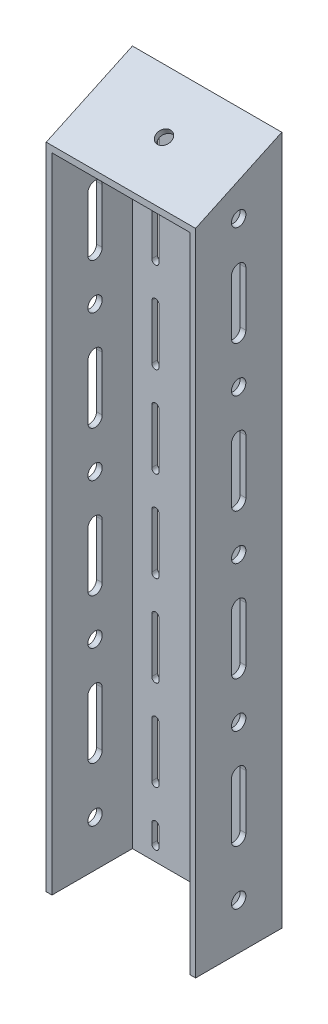
from build123d import *

# Parameters (mm, degrees)
BOSS_EXTRUDE1_DEPTH = 190.5
SKETCH2_R           = 3.96875
CUT_EXTRUDE1_DEPTH  = 190.5
CUT_EXTRUDE2_DEPTH  = 10
CUT_EXTRUDE3_DEPTH  = 100
BOSS_EXTRUDE3_REACH = 198.37
SKETCH7_R           = 3.96875
CUT_EXTRUDE4_DEPTH  = 5


with BuildPart() as part:
    # Sketch1 → Boss-Extrude1 (new, symmetric)
    with BuildSketch(Plane(origin=(0, 0, 0), x_dir=(1, 0, 0), z_dir=(0, 1, 0))):
        Polygon((-38.1, 20.64), (38.1, 20.64), (38.1, -23.815), (41.275, -23.815), (41.275, 23.815), (-41.275, 23.815), (-41.275, -23.815), (-38.1, -23.815), align=None)
    extrude(amount=BOSS_EXTRUDE1_DEPTH, both=True)

    # Sketch2 → Cut-Extrude1 (cut, symmetric)
    with BuildSketch(Plane(origin=(0, 0, 0), x_dir=(0, 0, -1), z_dir=(1, 0, 0))):
        with Locations((0, -165.1)):
            Circle(SKETCH2_R)
        with Locations((0, -79.975)):
            Circle(SKETCH2_R)
        with Locations((0, 0.275)):
            Circle(SKETCH2_R)
        with Locations((0, 80.525)):
            Circle(SKETCH2_R)
        with Locations((0, 161.05)):
            Circle(SKETCH2_R)
        with BuildLine():
            Line((-3.96875, -135.1), (-3.96875, -105.1))
            ThreePointArc((-3.96875, -105.1), (0, -101.13125), (3.96875, -105.1))
            Line((3.96875, -105.1), (3.96875, -135.1))
            ThreePointArc((3.96875, -135.1), (0, -139.06875), (-3.96875, -135.1))
        make_face()
        with BuildLine():
            Line((-3.96875, -54.85), (-3.96875, -24.85))
            ThreePointArc((-3.96875, -24.85), (0, -20.88125), (3.96875, -24.85))
            Line((3.96875, -24.85), (3.96875, -54.85))
            ThreePointArc((3.96875, -54.85), (0, -58.81875), (-3.96875, -54.85))
        make_face()
        with BuildLine():
            Line((-3.96875, 25.4), (-3.96875, 55.4))
            ThreePointArc((-3.96875, 55.4), (0, 59.36875), (3.96875, 55.4))
            Line((3.96875, 55.4), (3.96875, 25.4))
            ThreePointArc((3.96875, 25.4), (0, 21.43125), (-3.96875, 25.4))
        make_face()
        with BuildLine():
            Line((-3.96875, 105.65), (-3.96875, 135.65))
            ThreePointArc((-3.96875, 135.65), (0, 139.61875), (3.96875, 135.65))
            Line((3.96875, 135.65), (3.96875, 105.65))
            ThreePointArc((3.96875, 105.65), (0, 101.68125), (-3.96875, 105.65))
        make_face()
    extrude(amount=CUT_EXTRUDE1_DEPTH, both=True, mode=Mode.SUBTRACT)

    # Sketch3 → Cut-Extrude2 (cut)
    with BuildSketch(Plane(origin=(0, 0, -23.815), x_dir=(-1, 0, 0), z_dir=(0, 0, -1))):
        with BuildLine():
            Line((-1.984375, -178), (-1.984375, -148))
            ThreePointArc((-1.984375, -148), (0, -146.015625), (1.984375, -148))
            Line((1.984375, -148), (1.984375, -178))
            ThreePointArc((1.984375, -178), (0, -179.984375), (-1.984375, -178))
        make_face()
        with BuildLine():
            Line((-1.984375, -128), (-1.984375, -98))
            ThreePointArc((-1.984375, -98), (0, -96.015625), (1.984375, -98))
            Line((1.984375, -98), (1.984375, -128))
            ThreePointArc((1.984375, -128), (0, -129.984375), (-1.984375, -128))
        make_face()
        with BuildLine():
            Line((-1.984375, -78), (-1.984375, -48))
            ThreePointArc((-1.984375, -48), (0, -46.015625), (1.984375, -48))
            Line((1.984375, -48), (1.984375, -78))
            ThreePointArc((1.984375, -78), (0, -79.984375), (-1.984375, -78))
        make_face()
        with BuildLine():
            Line((-1.984375, -28), (-1.984375, 2))
            ThreePointArc((-1.984375, 2), (0, 3.984375), (1.984375, 2))
            Line((1.984375, 2), (1.984375, -28))
            ThreePointArc((1.984375, -28), (0, -29.984375), (-1.984375, -28))
        make_face()
        with BuildLine():
            Line((-1.984375, 22), (-1.984375, 52))
            ThreePointArc((-1.984375, 52), (0, 53.984375), (1.984375, 52))
            Line((1.984375, 52), (1.984375, 22))
            ThreePointArc((1.984375, 22), (0, 20.015625), (-1.984375, 22))
        make_face()
        with BuildLine():
            Line((-1.984375, 72), (-1.984375, 102))
            ThreePointArc((-1.984375, 102), (0, 103.984375), (1.984375, 102))
            Line((1.984375, 102), (1.984375, 72))
            ThreePointArc((1.984375, 72), (0, 70.015625), (-1.984375, 72))
        make_face()
        with BuildLine():
            Line((-1.984375, 122), (-1.984375, 152))
            ThreePointArc((-1.984375, 152), (0, 153.984375), (1.984375, 152))
            Line((1.984375, 152), (1.984375, 122))
            ThreePointArc((1.984375, 122), (0, 120.015625), (-1.984375, 122))
        make_face()
        with BuildLine():
            Line((23.415625, -152.78), (23.415625, -122.78))
            ThreePointArc((23.415625, -122.78), (25.4, -120.795625), (27.384375, -122.78))
            Line((27.384375, -122.78), (27.384375, -152.78))
            ThreePointArc((27.384375, -152.78), (25.4, -154.764375), (23.415625, -152.78))
        make_face()
        with BuildLine():
            Line((23.415625, -102.78), (23.415625, -72.78))
            ThreePointArc((23.415625, -72.78), (25.4, -70.795625), (27.384375, -72.78))
            Line((27.384375, -72.78), (27.384375, -102.78))
            ThreePointArc((27.384375, -102.78), (25.4, -104.764375), (23.415625, -102.78))
        make_face()
        with BuildLine():
            Line((23.415625, -52.78), (23.415625, -22.78))
            ThreePointArc((23.415625, -22.78), (25.4, -20.795625), (27.384375, -22.78))
            Line((27.384375, -22.78), (27.384375, -52.78))
            ThreePointArc((27.384375, -52.78), (25.4, -54.764375), (23.415625, -52.78))
        make_face()
        with BuildLine():
            Line((23.415625, -2.78), (23.415625, 27.22))
            ThreePointArc((23.415625, 27.22), (25.4, 29.204375), (27.384375, 27.22))
            Line((27.384375, 27.22), (27.384375, -2.78))
            ThreePointArc((27.384375, -2.78), (25.4, -4.764375), (23.415625, -2.78))
        make_face()
        with BuildLine():
            Line((23.415625, 47.22), (23.415625, 77.22))
            ThreePointArc((23.415625, 77.22), (25.4, 79.204375), (27.384375, 77.22))
            Line((27.384375, 77.22), (27.384375, 47.22))
            ThreePointArc((27.384375, 47.22), (25.4, 45.235625), (23.415625, 47.22))
        make_face()
        with BuildLine():
            Line((23.415625, 97.22), (23.415625, 127.22))
            ThreePointArc((23.415625, 127.22), (25.4, 129.204375), (27.384375, 127.22))
            Line((27.384375, 127.22), (27.384375, 97.22))
            ThreePointArc((27.384375, 97.22), (25.4, 95.235625), (23.415625, 97.22))
        make_face()
        with BuildLine():
            Line((23.415625, 147.22), (23.415625, 177.22))
            ThreePointArc((23.415625, 177.22), (25.4, 179.204375), (27.384375, 177.22))
            Line((27.384375, 177.22), (27.384375, 147.22))
            ThreePointArc((27.384375, 147.22), (25.4, 145.235625), (23.415625, 147.22))
        make_face()
        with BuildLine():
            Line((-27.384375, -152.78), (-27.384375, -122.78))
            ThreePointArc((-27.384375, -122.78), (-25.4, -120.795625), (-23.415625, -122.78))
            Line((-23.415625, -122.78), (-23.415625, -152.78))
            ThreePointArc((-23.415625, -152.78), (-25.4, -154.764375), (-27.384375, -152.78))
        make_face()
        with BuildLine():
            Line((-27.384375, -102.78), (-27.384375, -72.78))
            ThreePointArc((-27.384375, -72.78), (-25.4, -70.795625), (-23.415625, -72.78))
            Line((-23.415625, -72.78), (-23.415625, -102.78))
            ThreePointArc((-23.415625, -102.78), (-25.4, -104.764375), (-27.384375, -102.78))
        make_face()
        with BuildLine():
            Line((-27.384375, -52.78), (-27.384375, -22.78))
            ThreePointArc((-27.384375, -22.78), (-25.4, -20.795625), (-23.415625, -22.78))
            Line((-23.415625, -22.78), (-23.415625, -52.78))
            ThreePointArc((-23.415625, -52.78), (-25.4, -54.764375), (-27.384375, -52.78))
        make_face()
        with BuildLine():
            Line((-27.384375, -2.78), (-27.384375, 27.22))
            ThreePointArc((-27.384375, 27.22), (-25.4, 29.204375), (-23.415625, 27.22))
            Line((-23.415625, 27.22), (-23.415625, -2.78))
            ThreePointArc((-23.415625, -2.78), (-25.4, -4.764375), (-27.384375, -2.78))
        make_face()
        with BuildLine():
            Line((-27.384375, 47.22), (-27.384375, 77.22))
            ThreePointArc((-27.384375, 77.22), (-25.4, 79.204375), (-23.415625, 77.22))
            Line((-23.415625, 77.22), (-23.415625, 47.22))
            ThreePointArc((-23.415625, 47.22), (-25.4, 45.235625), (-27.384375, 47.22))
        make_face()
        with BuildLine():
            Line((-27.384375, 97.22), (-27.384375, 127.22))
            ThreePointArc((-27.384375, 127.22), (-25.4, 129.204375), (-23.415625, 127.22))
            Line((-23.415625, 127.22), (-23.415625, 97.22))
            ThreePointArc((-23.415625, 97.22), (-25.4, 95.235625), (-27.384375, 97.22))
        make_face()
        with BuildLine():
            Line((-27.384375, 147.22), (-27.384375, 177.22))
            ThreePointArc((-27.384375, 177.22), (-25.4, 179.204375), (-23.415625, 177.22))
            Line((-23.415625, 177.22), (-23.415625, 147.22))
            ThreePointArc((-23.415625, 147.22), (-25.4, 145.235625), (-27.384375, 147.22))
        make_face()
        with BuildLine():
            Line((27.384375, -172.78), (27.384375, -182.78))
            ThreePointArc((27.384375, -182.78), (25.4, -184.764375), (23.415625, -182.78))
            Line((23.415625, -182.78), (23.415625, -172.78))
            ThreePointArc((23.415625, -172.78), (25.4, -170.795625), (27.384375, -172.78))
        make_face()
        with BuildLine():
            Line((-23.415625, -172.78), (-23.415625, -182.78))
            ThreePointArc((-23.415625, -182.78), (-25.4, -184.764375), (-27.384375, -182.78))
            Line((-27.384375, -182.78), (-27.384375, -172.78))
            ThreePointArc((-27.384375, -172.78), (-25.4, -170.795625), (-23.415625, -172.78))
        make_face()
    extrude(amount=-CUT_EXTRUDE2_DEPTH, mode=Mode.SUBTRACT)

    # Sketch4 → Cut-Extrude3 (cut, symmetric)
    with BuildSketch(Plane(origin=(0, 0, 0), x_dir=(0, 0, -1), z_dir=(1, 0, 0))):
        Polygon((-23.815, 190.5), (23.815, 190.5), (-23.815, 168.289766242), align=None)
    extrude(amount=CUT_EXTRUDE3_DEPTH, both=True, mode=Mode.SUBTRACT)

    # Sketch6 → Boss-Extrude3 (add, up to next)
    with BuildSketch(Plane(origin=(0, 0, 0), x_dir=(0, 0, -1), z_dir=(1, 0, 0)), mode=Mode.PRIVATE) as boss_extrude3_sk1:
        Polygon((20.64, 185.516248293), (-23.815, 164.786541349), (-23.815, 168.289766242), (20.64, 189.019473185), align=None)
    boss_extrude3_tool1 = extrude(boss_extrude3_sk1.sketch, amount=-BOSS_EXTRUDE3_REACH, mode=Mode.PRIVATE) - part.part
    boss_extrude3 = boss_extrude3_tool1.solids().sort_by_distance((0, 176.903007, 1.5875))[0]
    add(boss_extrude3)

    # Mirror1: Boss-Extrude3 across plane
    add(boss_extrude3.mirror(Plane(origin=(0, 0, 0), x_dir=(0, 0, 1), z_dir=(1, 0, 0))))

    # Sketch7 → Cut-Extrude4 (cut, symmetric)
    with BuildSketch(Plane(origin=(0, 147.353845616, 68.712226669), x_dir=(1, 0, 0), z_dir=(0, 0.906307787036648, 0.42261826174070377))):
        with Locations(Location((0, 75.81555367, 0), (0, 0, 90))):
            Circle(SKETCH7_R)
    extrude(amount=CUT_EXTRUDE4_DEPTH, both=True, mode=Mode.SUBTRACT)


solid = part.part
